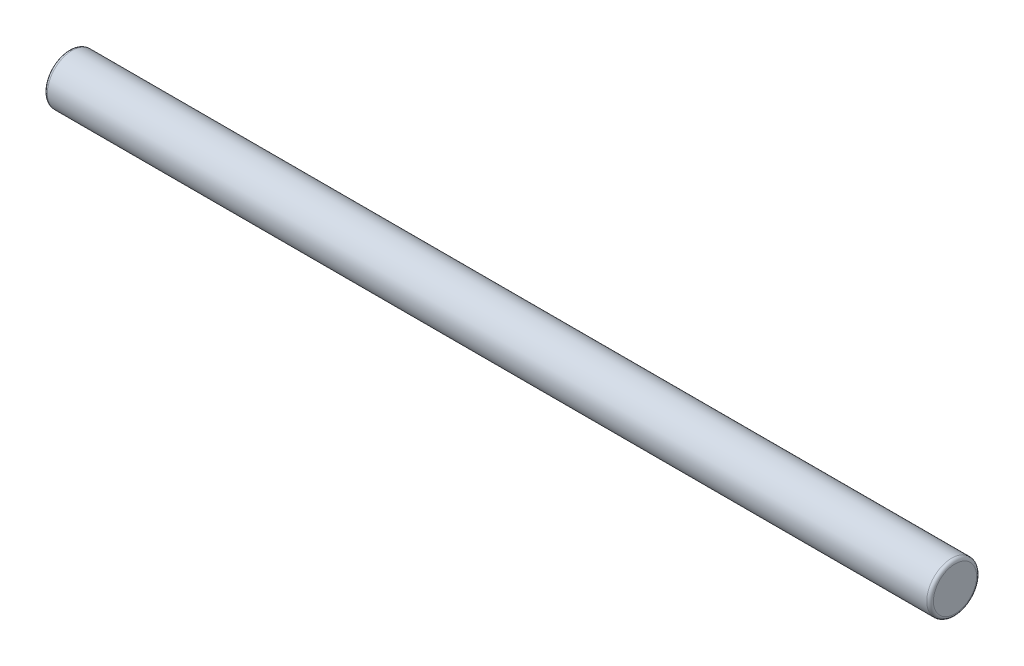
from build123d import *

# Parameters (mm, degrees)
SKETCH1_R           = 2.25
BOSS_EXTRUDE1_DEPTH = 40
FILLET1_R           = 0.3


with BuildPart() as part:
    # Sketch1 → Boss-Extrude1 (new, symmetric)
    with BuildSketch(Plane(origin=(0, 0, 0), x_dir=(0, 0, -1), z_dir=(1, 0, 0))):
        Circle(SKETCH1_R)
    extrude(amount=BOSS_EXTRUDE1_DEPTH, both=True)

    # Fillet1
    fillet1_edges = [part.edges().sort_by_distance(p)[0] for p in [
        (-40, 0, 2.25),
        (40, 0, 2.25),
    ]]
    fillet(fillet1_edges, radius=FILLET1_R)


solid = part.part
